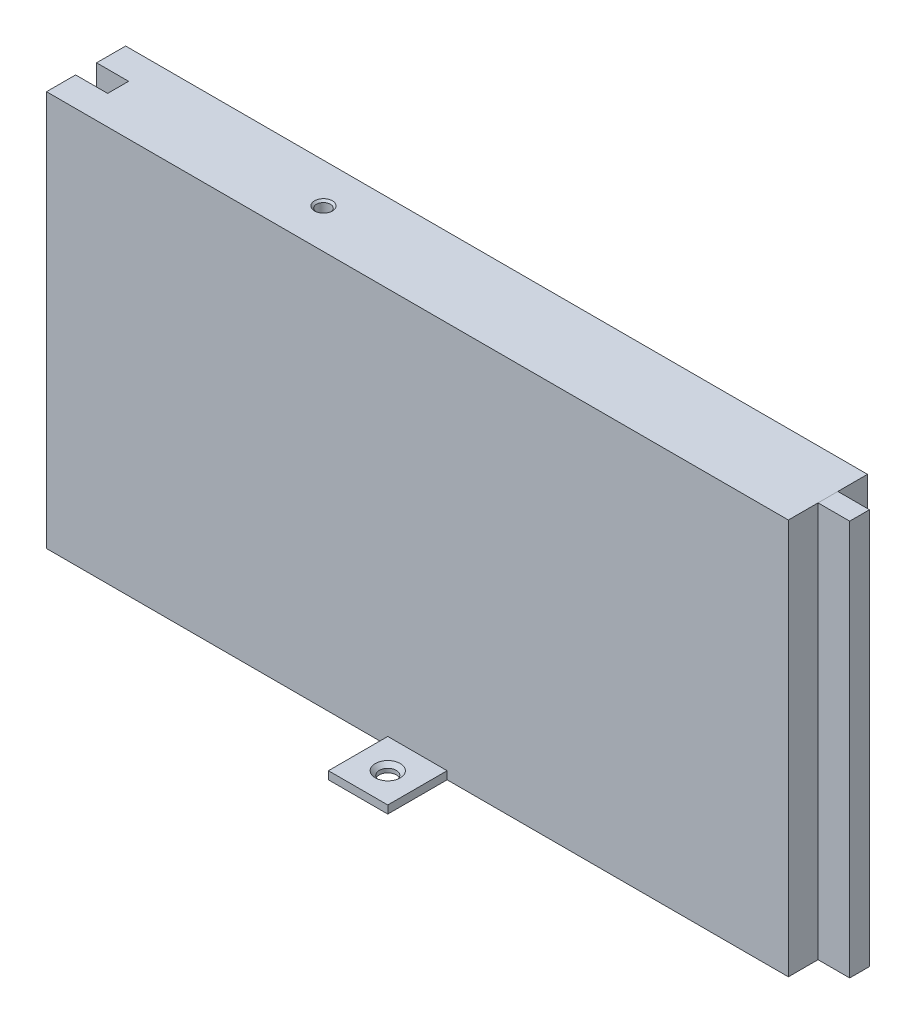
from build123d import *

# Parameters (mm, degrees)
SKETCH1_W           = 187.5
SKETCH1_H           = 20
BOSS_EXTRUDE1_DEPTH = 100
SKETCH2_W           = 8.1
SKETCH2_H           = 5.3
CUT_EXTRUDE1_DEPTH  = 100
SKETCH4_W           = 8
SKETCH4_H           = 5
BOSS_EXTRUDE2_DEPTH = 100
SKETCH5_R           = 1.75
CUT_EXTRUDE2_DEPTH  = 8
CHAMFER2_SIZE       = 0.5
SKETCH6_W           = 15
SKETCH6_H           = 2
BOSS_EXTRUDE3_DEPTH = 15
SKETCH7_W           = 15
SKETCH7_H           = 2
BOSS_EXTRUDE4_DEPTH = 15
SKETCH8_R           = 2.15
CUT_EXTRUDE3_DEPTH  = 15
CHAMFER3_SIZE       = 1


with BuildPart() as part:
    # Sketch1 → Boss-Extrude1 (new body)
    with BuildSketch(Plane(origin=(0, 0, 0), x_dir=(1, 0, 0), z_dir=(0, 1, 0))):
        with Locations((93.75, 10)):
            Rectangle(SKETCH1_W, SKETCH1_H)
    extrude(amount=BOSS_EXTRUDE1_DEPTH)

    # Sketch2 → Cut-Extrude1 (cut)
    with BuildSketch(Plane(origin=(0, 100, 0), x_dir=(1, 0, 0), z_dir=(0, 1, 0))):
        with Locations((4.05, 10)):
            Rectangle(SKETCH2_W, SKETCH2_H)
    extrude(amount=-CUT_EXTRUDE1_DEPTH, mode=Mode.SUBTRACT)

    # Sketch5 → Cut-Extrude2 (cut)
    with BuildSketch(Plane(origin=(0, 100, 0), x_dir=(1, 0, 0), z_dir=(0, 1, 0))):
        with Locations(Location((60, 10, 0), (0, 0, 270))):
            Circle(SKETCH5_R)
    extrude(amount=-CUT_EXTRUDE2_DEPTH, mode=Mode.SUBTRACT)

    # Chamfer2
    chamfer2_edges = [part.edges().sort_by_distance(p)[0] for p in [
        (60, 100, -11.75),
    ]]
    chamfer(chamfer2_edges, length=CHAMFER2_SIZE)

    # Sketch6 → Boss-Extrude3 (add)
    with BuildSketch(Plane(origin=(0, 0, -20), x_dir=(-1, 0, 0), z_dir=(0, 0, -1))):
        with Locations((-93.75, 1)):
            Rectangle(SKETCH6_W, SKETCH6_H)
    extrude(amount=BOSS_EXTRUDE3_DEPTH)

    # Sketch7 → Boss-Extrude4 (add)
    with BuildSketch(Plane.XY):
        with Locations((93.75, 1)):
            Rectangle(SKETCH7_W, SKETCH7_H)
    extrude(amount=BOSS_EXTRUDE4_DEPTH)

    # Sketch8 → Cut-Extrude3 (cut)
    with BuildSketch(Plane(origin=(0, 2, 0), x_dir=(1, 0, 0), z_dir=(0, 1, 0))):
        with Locations(Location((93.75, 27.5, 0), (0, 0, 180))):
            Circle(SKETCH8_R)
        with Locations(Location((93.75, -7.5, 0), (0, 0, 180))):
            Circle(SKETCH8_R)
    extrude(amount=-CUT_EXTRUDE3_DEPTH, mode=Mode.SUBTRACT)

    # Chamfer3
    chamfer3_edges = [part.edges().sort_by_distance(p)[0] for p in [
        (95.9, 2, -27.5),
        (95.9, 2, 7.5),
    ]]
    chamfer(chamfer3_edges, length=CHAMFER3_SIZE)


with BuildPart() as body_2:
    # Sketch4 → Boss-Extrude2 (new body)
    with BuildSketch(Plane(origin=(0, 100, 0), x_dir=(1, 0, 0), z_dir=(0, 1, 0))):
        with Locations((191.5, 10)):
            Rectangle(SKETCH4_W, SKETCH4_H)
    extrude(amount=-BOSS_EXTRUDE2_DEPTH)


solid = Compound([part.part, body_2.part])
